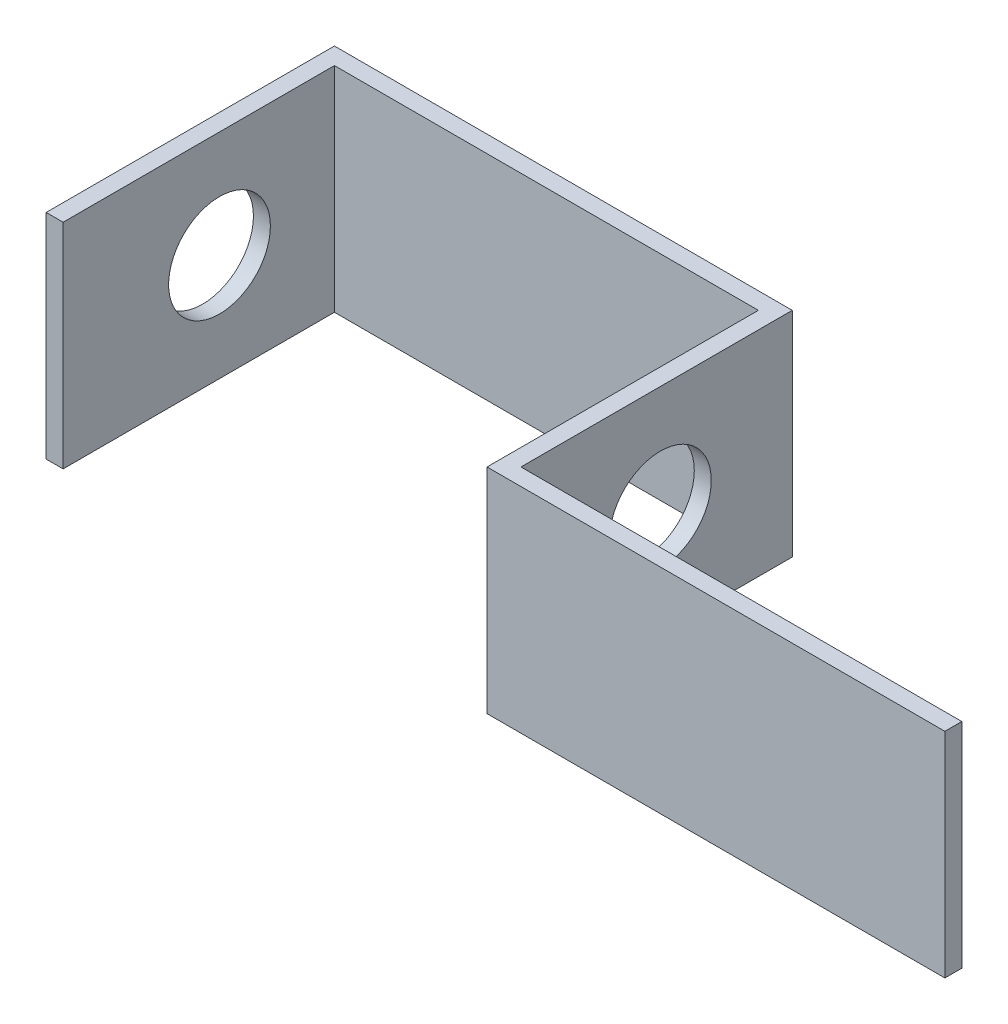
from build123d import *

# Parameters (mm, degrees)
BOSS_EXTRUDE1_DEPTH = 80.01
SKETCH2_R           = 19.05
CUT_EXTRUDE1_DEPTH  = 175.768


with BuildPart() as part:
    # Sketch1 → Boss-Extrude1 (new body)
    with BuildSketch(Plane(origin=(0, 0, 0), x_dir=(1, 0, 0), z_dir=(0, 1, 0))):
        Polygon((85.725, 0), (85.725, 101.6), (-85.725, 101.6), (-85.725, -6.35), (-79.375, -6.35), (-79.375, 95.25), (79.375, 95.25), (79.375, -6.35), (110.08813222, -6.35), (250.825, -6.35), (250.825, 0), align=None)
    extrude(amount=BOSS_EXTRUDE1_DEPTH)

    # Sketch2 → Cut-Extrude1 (cut)
    with BuildSketch(Plane(origin=(85.725, 0, 0), x_dir=(0, 0, -1), z_dir=(1, 0, 0))):
        with Locations((52.214904531, 40.005)):
            Circle(SKETCH2_R)
    extrude(amount=-CUT_EXTRUDE1_DEPTH, mode=Mode.SUBTRACT)


solid = part.part
